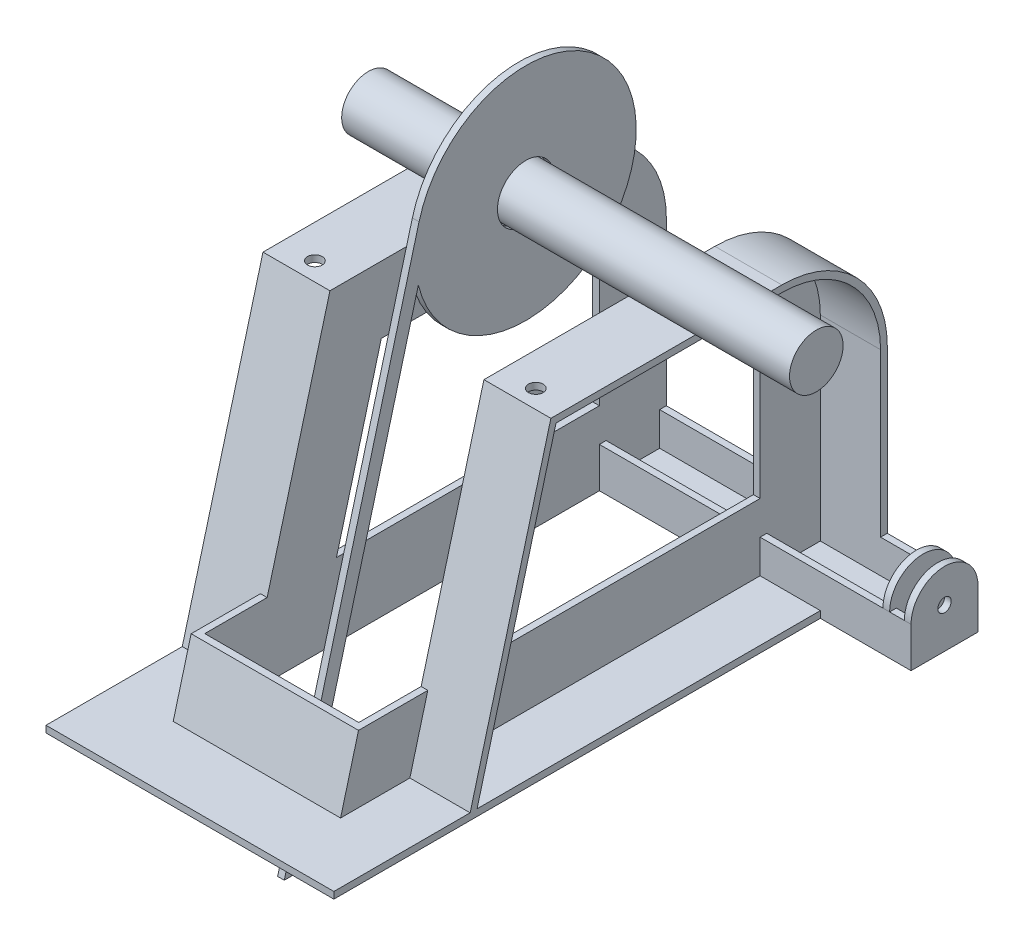
from build123d import *

# Parameters (mm, degrees)
SKETCH2_W               = 669
SKETCH2_H               = 40
SKETCH6_R               = 10
BOSS_EXTRUDE1_DEPTH     = 21
CUT_EXTRUDE1_DEPTH      = 943.072184071
CUT_EXTRUDE1_DEPTH_BACK = 943.072184071
SKETCH7_W               = 22
SKETCH7_H               = 150
BOSS_EXTRUDE12_DEPTH    = 10
EXTRUDE_THIN8_DEPTH     = 90
EXTRUDE_THIN9_START     = -465.5
SKETCH34_W              = 10
SKETCH34_H              = 50
EXTRUDE_THIN9_DEPTH     = 455.5
SKETCH36_W              = 230
SKETCH36_H              = 626.604754635
BOSS_EXTRUDE13_DEPTH    = 10
BOSS_EXTRUDE14_START    = -240
BOSS_EXTRUDE14_DEPTH    = 230
SKETCH38_R              = 11
CUT_EXTRUDE3_DEPTH      = 10
SKETCH20_R              = 42.299208509
BOSS_EXTRUDE15_DEPTH    = 5


with BuildPart() as part:
    # Sketch2 → Revolve1 (revolve)
    with BuildSketch(Plane.XY, mode=Mode.PRIVATE) as revolve1_sk:
        with Locations((269.5, 20)):
            Rectangle(SKETCH2_W, SKETCH2_H)
    revolve(revolve1_sk.sketch.rotate(Axis((-65, 0, 0), (1, 0, 0)), 90), axis=Axis((-65, 0, 0), (1, 0, 0)))


with BuildPart() as body_2:
    # Sketch6 → Boss-Extrude1 (new, symmetric)
    with BuildSketch(Plane(origin=(494.5, 0, 0), x_dir=(0, 0, -1), z_dir=(1, 0, 0))):
        with BuildLine():
            Line((230, -500), (230, -550))
            Line((230, -550), (280, -550))
            Line((280, -550), (330, -550))
            Line((330, -550), (330, -500))
            ThreePointArc((330, -500), (280, -450), (230, -500))
        make_face()
        with Locations(Location((280, -500, 0), (0, 0, 180))):
            Circle(SKETCH6_R, mode=Mode.SUBTRACT)
    extrude(amount=BOSS_EXTRUDE1_DEPTH, both=True)

    # Sketch7 → Cut-Extrude1 (cut, two sides: drawn at the far end of the back side and taken through both)
    with BuildSketch(Plane(origin=(625, 0, 0), x_dir=(-1, 0, 0), z_dir=(0, -1, 0)).offset(-CUT_EXTRUDE1_DEPTH_BACK)):
        with Locations((130.5, 280)):
            Rectangle(SKETCH7_W, SKETCH7_H)
    extrude(amount=CUT_EXTRUDE1_DEPTH + CUT_EXTRUDE1_DEPTH_BACK, mode=Mode.SUBTRACT)


with BuildPart() as cut_extrude1_piece_1:
    # of the separate pieces the step leaves, piece 1, a body of its own (cut_extrude1_pieces)
    add(body_2.part.solids().sort_by_distance((483.5, -500, -230))[0])



with BuildPart() as cut_extrude1_piece_2:
    # of the separate pieces the step leaves, piece 2, a body of its own (cut_extrude1_pieces)
    add(body_2.part.solids().sort_by_distance((515.5, -500, -230))[0])


with BuildPart() as body_4:
    # Sketch30 → Boss-Extrude12 (new body)
    with BuildSketch(Plane(origin=(50, 0, 0), x_dir=(0, 0, -1), z_dir=(1, 0, 0))):
        with BuildLine():
            ThreePointArc((330, -257.5), (283.869318037, -146.130681963), (172.5, -100))
            Line((172.5, -100), (122.5, -100))
            Line((122.5, -100), (-172.5, -100))
            Line((-172.5, -100), (-266.282217351, -450))
            Line((-266.282217351, -450), (-369.809835392, -450))
            Line((-369.809835392, -450), (-396.604754635, -550))
            Line((-396.604754635, -550), (-293.077136594, -550))
            Line((-293.077136594, -550), (-189.549518553, -550))
            Line((-189.549518553, -550), (230, -550))
            Line((230, -550), (330, -550))
            Line((330, -550), (330, -500))
            Line((330, -500), (330, -257.5))
        make_face()
        with BuildLine():
            ThreePointArc((172.5, -200), (213.158639918, -216.841360082), (230, -257.5))
            Line((230, -257.5), (230, -450))
            Line((230, -450), (-162.75459931, -450))
            Line((-162.75459931, -450), (-95.767301202, -200))
            Line((-95.767301202, -200), (122.5, -200))
            Line((122.5, -200), (172.5, -200))
        make_face(mode=Mode.SUBTRACT)
    extrude(amount=-BOSS_EXTRUDE12_DEPTH)

    # Sketch31 → Extrude-Thin8 (add)
    with BuildSketch(Plane.ZY.offset(-40)):
        with BuildLine():
            Line((293.077136594, -550), (172.5, -100))
            Line((172.5, -100), (-172.5, -100))
            ThreePointArc((-172.5, -100), (-283.869318037, -146.130681963), (-330, -257.5))
            Line((-330, -257.5), (-330, -550))
            Line((-330, -550), (-320, -550))
            Line((-320, -550), (-320, -257.5))
            ThreePointArc((-320, -257.5), (-276.798250225, -153.201749775), (-172.5, -110))
            Line((-172.5, -110), (164.82673012, -110))
            Line((164.82673012, -110), (283.417878331, -552.588190451))
            Line((283.417878331, -552.588190451), (293.077136594, -550))
        make_face()
    extrude(amount=EXTRUDE_THIN8_DEPTH)


with BuildPart() as body_5:
    # Mirror8: mirrored copy
    add(body_4.part.mirror(Plane(origin=(165, 0, 0), x_dir=(0, 0, 1), z_dir=(1, 0, 0))))


with BuildPart() as cut_extrude1_piece_1_1:
    add(cut_extrude1_piece_1.part)

    add(cut_extrude1_piece_2.part)  # Extrude-Thin9 merges Cut-Extrude1 piece 2

    add(body_4.part)  # Extrude-Thin9 merges body 4

    add(body_5.part)  # Extrude-Thin9 merges body 5
    # Sketch34 → Extrude-Thin9 (add)
    with BuildSketch(Plane(origin=(515.5, 0, 0), x_dir=(0, 0, -1), z_dir=(1, 0, 0)).offset(EXTRUDE_THIN9_START)):
        with Locations((235, -525)):
            Rectangle(SKETCH34_W, SKETCH34_H)
        with Locations((325, -525)):
            Rectangle(SKETCH34_W, SKETCH34_H)
    extrude(amount=EXTRUDE_THIN9_DEPTH)

    # Sketch36 → Boss-Extrude13 (add)
    with BuildSketch(Plane(origin=(0, -550, 0), x_dir=(-1, 0, 0), z_dir=(0, -1, 0))):
        Polygon((-280, 330), (-380, 330), (-515.5, 330), (-515.5, 230), (-380, 230), (-380, -496.604754635), (50, -496.604754635), (50, 330), (-50, 330), align=None)
        with Locations((-165, -83.302377317)):
            Rectangle(SKETCH36_W, SKETCH36_H, mode=Mode.SUBTRACT)
    extrude(amount=BOSS_EXTRUDE13_DEPTH)

    # Sketch37 → Boss-Extrude14 (add)
    with BuildSketch(Plane(origin=(290, 0, 0), x_dir=(0, 0, -1), z_dir=(1, 0, 0)).offset(BOSS_EXTRUDE14_START)):
        Polygon((-369.809835392, -450), (-396.604754635, -550), (-396.604754635, -560), (-388.931484755, -560), (-359.457073588, -450), align=None)
    extrude(amount=BOSS_EXTRUDE14_DEPTH)

    # Sketch38 → Cut-Extrude3 (cut)
    with BuildSketch(Plane(origin=(0, -100, 0), x_dir=(1, 0, 0), z_dir=(0, 1, 0))):
        with Locations(Location((0, 145, 0), (0, 0, 270))):
            Circle(SKETCH38_R)
        with Locations(Location((0, -145, 0), (0, 0, 270))):
            Circle(SKETCH38_R)
        with Locations(Location((330, 145, 0), (0, 0, 270))):
            Circle(SKETCH38_R)
        with Locations(Location((330, -145, 0), (0, 0, 270))):
            Circle(SKETCH38_R)
    extrude(amount=-CUT_EXTRUDE3_DEPTH, mode=Mode.SUBTRACT)


with BuildPart() as body_3:
    # Sketch20 → Boss-Extrude15 (new, symmetric)
    with BuildSketch(Plane(origin=(165, 0, 0), x_dir=(0, 0, -1), z_dir=(1, 0, 0))):
        with BuildLine():
            Line((-159.377761338, 42.705142442), (-360.657862956, -708.482423351))
            Line((-360.657862956, -708.482423351), (-339.952339348, -708.482423351))
            Line((-339.952339348, -708.482423351), (-160.438676803, -38.528314079))
            ThreePointArc((-160.438676803, -38.528314079), (164.98593013, -2.154729496), (-159.377761338, 42.705142442))
        make_face()
        Circle(SKETCH20_R, mode=Mode.SUBTRACT)
    extrude(amount=BOSS_EXTRUDE15_DEPTH, both=True)


solid = Compound([part.part, cut_extrude1_piece_1_1.part, body_3.part])
